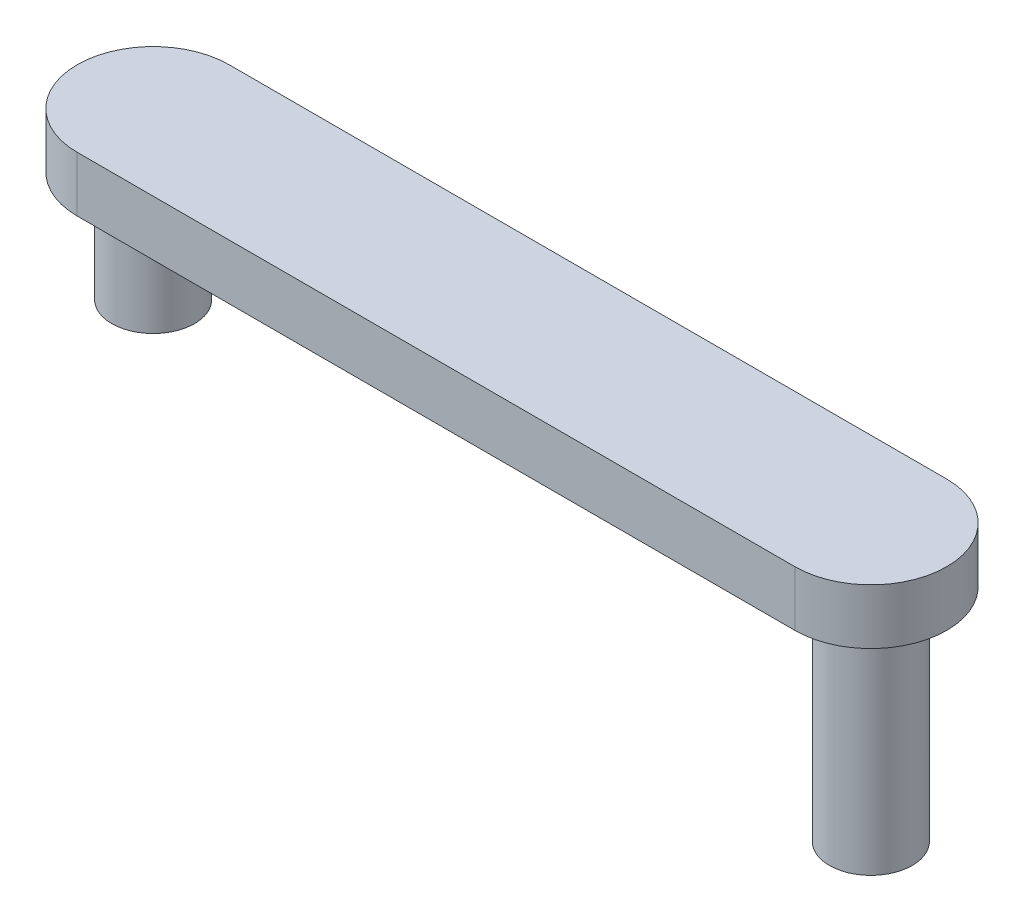
from build123d import *

# Parameters (mm, degrees)
SKETCH1_R           = 1.5
BOSS_EXTRUDE1_DEPTH = 4
BOSS_EXTRUDE2_DEPTH = 2
SKETCH3_R           = 1.5
BOSS_EXTRUDE3_DEPTH = 8


with BuildPart() as part:
    # Sketch1 → Boss-Extrude1 (new body)
    with BuildSketch(Plane(origin=(0, 0, 0), x_dir=(1, 0, 0), z_dir=(0, 1, 0))):
        with Locations(Location((0, 0, 0), (0, 0, 270))):
            Circle(SKETCH1_R)
    extrude(amount=BOSS_EXTRUDE1_DEPTH)

    # Sketch2 → Boss-Extrude2 (add)
    with BuildSketch(Plane(origin=(0, 4, 0), x_dir=(1, 0, 0), z_dir=(0, 1, 0))):
        with BuildLine():
            Line((0, 2.75), (26, 2.75))
            ThreePointArc((26, 2.75), (28.75, 0), (26, -2.75))
            Line((26, -2.75), (0, -2.75))
            ThreePointArc((0, -2.75), (-2.75, 0), (0, 2.75))
        make_face()
    extrude(amount=BOSS_EXTRUDE2_DEPTH)

    # Sketch3 → Boss-Extrude3 (add)
    with BuildSketch(Plane.XZ.offset(-4)):
        with Locations(Location((26, 0, 0), (0, 0, 90))):
            Circle(SKETCH3_R)
    extrude(amount=BOSS_EXTRUDE3_DEPTH)


solid = part.part
